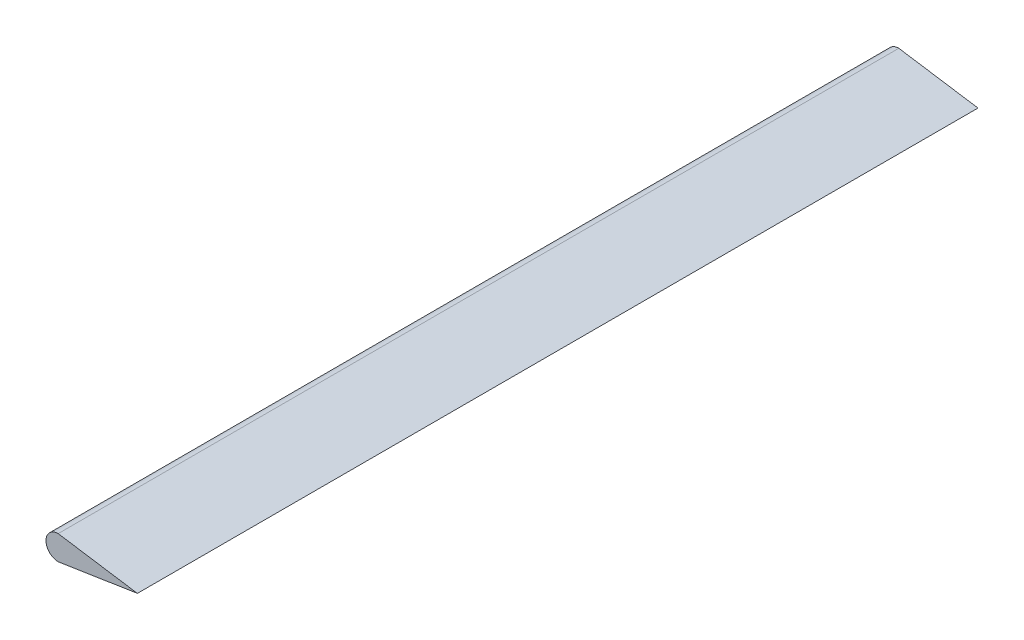
from build123d import *

# Parameters (mm, degrees)
BOSS_EXTRUDE2_DEPTH = 13800


with BuildPart() as part:
    # Sketch1 → Boss-Extrude2 (new body)
    with BuildSketch(Plane.XY):
        with BuildLine():
            Line((200, 200), (1500, 0))
            Line((1500, 0), (200, -200))
            ThreePointArc((200, -200), (0, 0), (200, 200))
        make_face()
    extrude(amount=BOSS_EXTRUDE2_DEPTH)


solid = part.part
